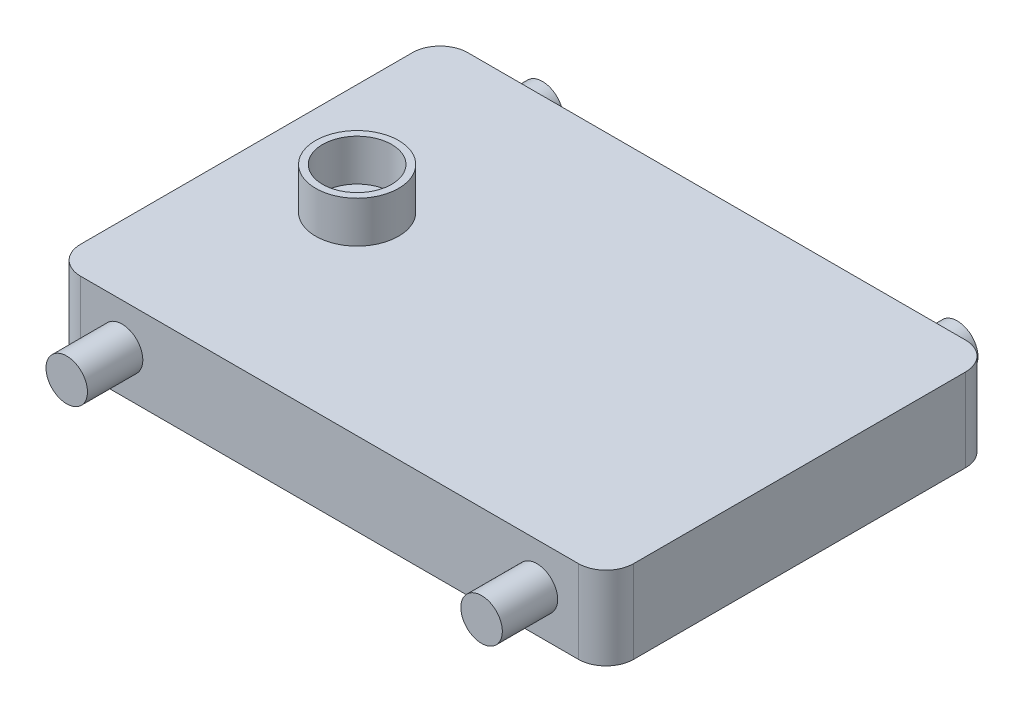
from build123d import *

# Parameters (mm, degrees)
SKETCH1_W           = 200
SKETCH1_H           = 140
BOSS_EXTRUDE1_DEPTH = 30
FILLET1_R           = 10
SKETCH2_R           = 7.5
BOSS_EXTRUDE2_DEPTH = 20
BOSS_EXTRUDE3_START = 12
SKETCH4_R           = 7.5
BOSS_EXTRUDE3_DEPTH = 12
SKETCH6_R           = 15
SKETCH6_R_2         = 12.5
BOSS_EXTRUDE4_DEPTH = 45


with BuildPart() as part:
    # Sketch1 → Boss-Extrude1 (new body)
    with BuildSketch(Plane(origin=(0, 0, 0), x_dir=(1, 0, 0), z_dir=(0, 1, 0))):
        Rectangle(SKETCH1_W, SKETCH1_H)
    extrude(amount=BOSS_EXTRUDE1_DEPTH)

    # Fillet1
    fillet1_edges = [part.edges().sort_by_distance(p)[0] for p in [
        (100, 15, 70),
        (-100, 15, 70),
        (-100, 15, -70),
        (100, 15, -70),
    ]]
    fillet(fillet1_edges, radius=FILLET1_R)

    # Sketch2 → Boss-Extrude2 (add)
    with BuildSketch(Plane.XY.offset(70)):
        with Locations(Location((-75, 15, 0), (0, 0, 180))):
            Circle(SKETCH2_R)
        with Locations(Location((75, 15, 0), (0, 0, 180))):
            Circle(SKETCH2_R)
    extrude(amount=BOSS_EXTRUDE2_DEPTH)

    # Sketch4 → Boss-Extrude3 (add)
    with BuildSketch(Plane(origin=(0, 0, -70), x_dir=(-1, 0, 0), z_dir=(0, 0, -1)).offset(BOSS_EXTRUDE3_START)):
        with Locations((-75, 15)):
            Circle(SKETCH4_R)
        with Locations((75, 15)):
            Circle(SKETCH4_R)
    extrude(amount=-BOSS_EXTRUDE3_DEPTH)

    # Sketch6 → Boss-Extrude4 (add)
    with BuildSketch(Plane.XZ):
        with Locations(Location((-60, 0, 0), (0, 0, 270))):
            Circle(SKETCH6_R)
        with Locations(Location((-60, 0, 0), (0, 0, 270))):
            Circle(SKETCH6_R_2, mode=Mode.SUBTRACT)
    extrude(amount=-BOSS_EXTRUDE4_DEPTH)


solid = part.part
